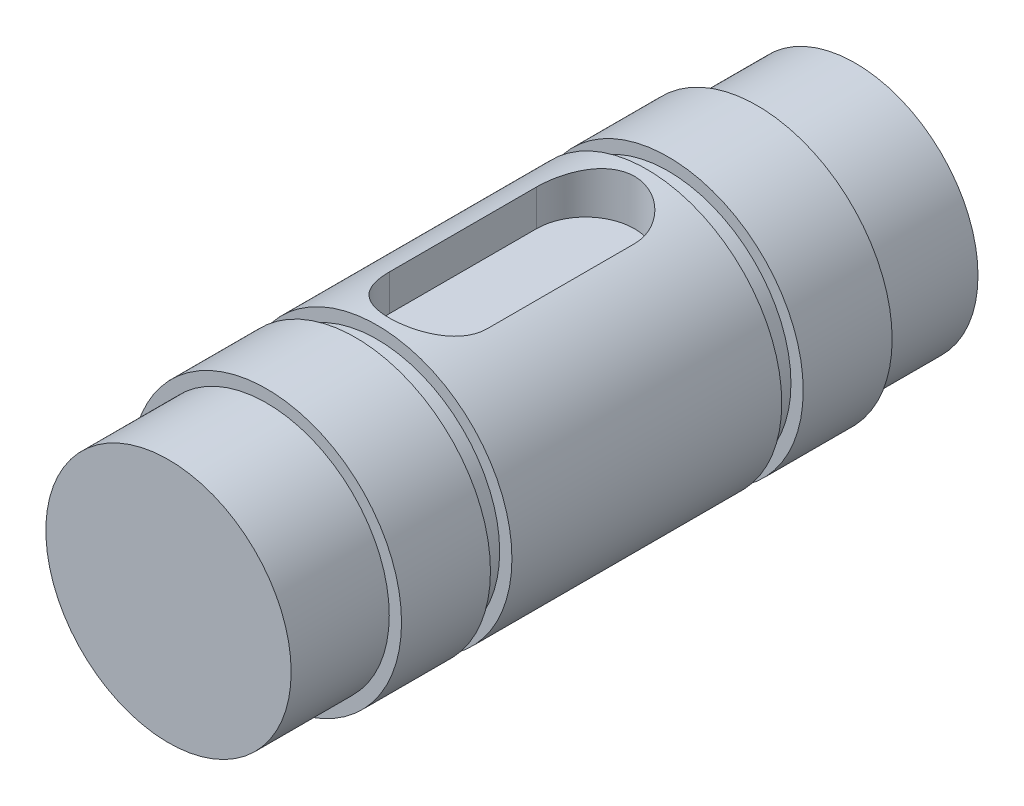
from build123d import *

# Parameters (mm, degrees)
SKETCH2_R           = 11
BOSS_EXTRUDE1_DEPTH = 20
SKETCH3_R           = 10
BOSS_EXTRUDE2_DEPTH = 8
SKETCH4_W           = 8
SKETCH4_H           = 12
CUT_EXTRUDE1_DEPTH  = 3.7
SKETCH6_OUTSIDE_W   = 36.812
SKETCH6_OUTSIDE_H   = 36.812
SKETCH6_OUTSIDE_R   = 10
CUT_EXTRUDE4_DEPTH  = 1.75


with BuildPart() as part:
    # Sketch2 → Boss-Extrude1 (new body)
    with BuildSketch(Plane.XY):
        Circle(SKETCH2_R)
    extrude(amount=BOSS_EXTRUDE1_DEPTH)

    # Sketch3 → Boss-Extrude2 (add)
    with BuildSketch(Plane.XY.offset(20)):
        Circle(SKETCH3_R)
    extrude(amount=BOSS_EXTRUDE2_DEPTH)

    # Mirror1: part across plane


with BuildPart() as part_1:
    add(part.part)
    add(part.part.mirror(Plane.XY))

    # Sketch4 → Cut-Extrude1 (cut)
    with BuildSketch(Plane(origin=(0, 11, 0), x_dir=(1, 0, 0), z_dir=(0, 1, 0))):
        Rectangle(SKETCH4_W, SKETCH4_H)
        with BuildLine():
            ThreePointArc((-4, 6), (0, 10), (4, 6))
            Line((4, 6), (-4, 6))
        make_face()
        with BuildLine():
            Line((-4, -6), (4, -6))
            ThreePointArc((4, -6), (0, -10), (-4, -6))
        make_face()
    extrude(amount=-CUT_EXTRUDE1_DEPTH, mode=Mode.SUBTRACT)

    # Sketch6 outside → Cut-Extrude4 (cut)
    with BuildSketch(Plane.XY.offset(11)):
        Rectangle(SKETCH6_OUTSIDE_W, SKETCH6_OUTSIDE_H)
        Circle(SKETCH6_OUTSIDE_R, mode=Mode.SUBTRACT)
    cut_extrude4 = extrude(amount=CUT_EXTRUDE4_DEPTH, mode=Mode.SUBTRACT)

    # Mirror2: Cut-Extrude4 across plane
    add(cut_extrude4.mirror(Plane.XY), mode=Mode.SUBTRACT)


solid = part_1.part
